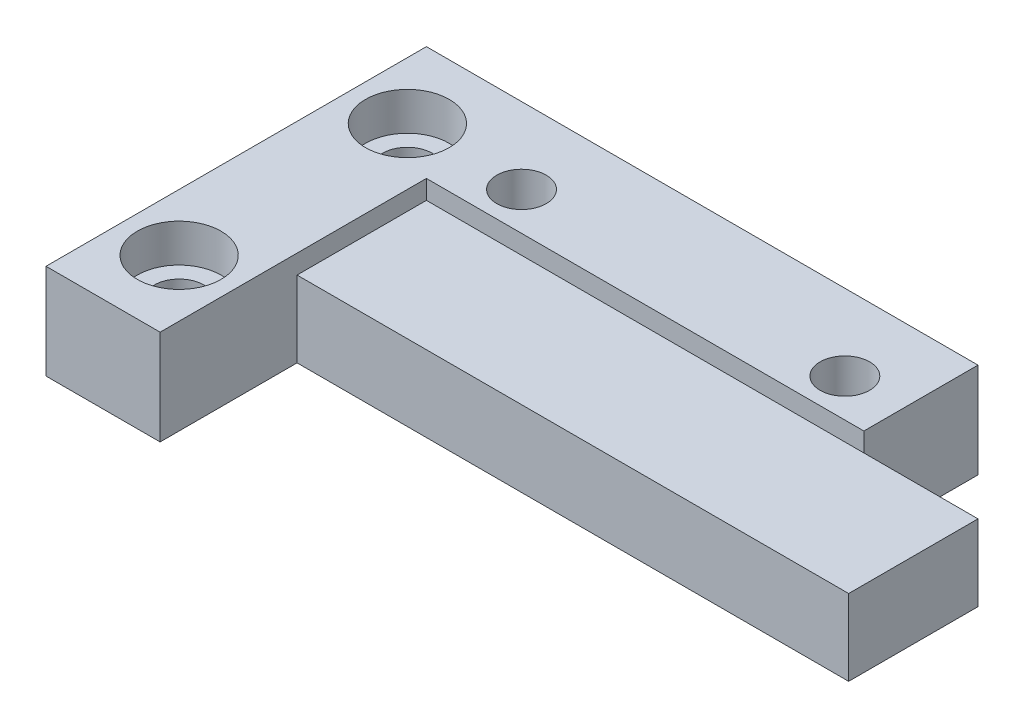
from build123d import *

# Parameters (mm, degrees)
SKETCH_1_W           = 35
SKETCH_1_H           = 20
EXTRUDE_1_DEPTH      = 5
SKETCH_2_W           = 29
SKETCH_2_H           = 14
CUT_EXTRUDE_2_DEPTH  = 1
SKETCH_3_W           = 29
SKETCH_3_H           = 7.2
CUT_EXTRUDE_4_DEPTH  = 41.620192023
SKETCH_4_W           = 6
SKETCH_4_H           = 6
CUT_EXTRUDE_5_DEPTH  = 41.620192023
SKETCH_5_R           = 1.3
CUT_EXTRUDE_6_DEPTH  = 41.620192023
CUT_EXTRUDE_START    = 5
CUT_EXTRUDE_8_DEPTH  = 2.3
SKETCH_6_R           = 2.2
CUT_EXTRUDE_10_DEPTH = 2
SKETCH_8_W           = 36.682005336
SKETCH_8_H           = 21.284799138
CUT_EXTRUDE_11_DEPTH = 5


with BuildPart() as part:
    # 草圖1 → 填料-伸長1 (new body)
    with BuildSketch(Plane(origin=(0, 0, 0), x_dir=(1, 0, 0), z_dir=(0, 1, 0))):
        with Locations((17.5, 10)):
            Rectangle(SKETCH_1_W, SKETCH_1_H)
    extrude_1 = extrude(amount=EXTRUDE_1_DEPTH)

    # 草圖2 → 除料-伸長2 (cut)
    with BuildSketch(Plane(origin=(0, 0, 0), x_dir=(1, 0, 0), z_dir=(0, 1, 0))):
        with Locations((20.5, 7)):
            Rectangle(SKETCH_2_W, SKETCH_2_H)
    cut_extrude_2 = extrude(amount=CUT_EXTRUDE_2_DEPTH, mode=Mode.SUBTRACT)

    # 草圖3 → 除料-伸長4 (cut, through all)
    with BuildSketch(Plane(origin=(0, 0, 0), x_dir=(1, 0, 0), z_dir=(0, 1, 0))):
        with Locations((20.5, 3.6)):
            Rectangle(SKETCH_3_W, SKETCH_3_H)
    cut_extrude_4 = extrude(amount=CUT_EXTRUDE_4_DEPTH, mode=Mode.SUBTRACT)

    # 草圖4 → 除料-伸長5 (cut, through all)
    with BuildSketch(Plane(origin=(0, 0, 0), x_dir=(1, 0, 0), z_dir=(0, 1, 0))):
        with Locations((32, 17)):
            Rectangle(SKETCH_4_W, SKETCH_4_H)
    cut_extrude_5 = extrude(amount=CUT_EXTRUDE_5_DEPTH, mode=Mode.SUBTRACT)

    # 草圖5 → 除料-伸長6 (cut, through all)
    with BuildSketch(Plane(origin=(0, 0, 0), x_dir=(1, 0, 0), z_dir=(0, 1, 0))):
        with Locations(Location((3, 16, 0), (0, 0, 270))):
            Circle(SKETCH_5_R)
        with Locations(Location((3, 4, 0), (0, 0, 270))):
            Circle(SKETCH_5_R)
        with Locations(Location((9, 16, 0), (0, 0, 270))):
            Circle(SKETCH_5_R)
        with Locations(Location((26, 16, 0), (0, 0, 270))):
            Circle(SKETCH_5_R)
    cut_extrude_6 = extrude(amount=CUT_EXTRUDE_6_DEPTH, mode=Mode.SUBTRACT)

    # 草圖7 → 除料-伸長8 (cut)
    with BuildSketch(Plane(origin=(0, 0, 0), x_dir=(1, 0, 0), z_dir=(0, 1, 0)).offset(CUT_EXTRUDE_START)):
        Polygon((26, 18.4), (23.921539031, 17.2), (23.921539031, 14.8), (26, 13.6), (28.078460969, 14.8), (28.078460969, 17.2), align=None)
        Polygon((9, 18.4), (6.921539031, 17.2), (6.921539031, 14.8), (9, 13.6), (11.078460969, 14.8), (11.078460969, 17.2), align=None)
    cut_extrude_8 = extrude(amount=-CUT_EXTRUDE_8_DEPTH, mode=Mode.SUBTRACT)

    # 草圖6 → 除料-伸長10 (cut)
    with BuildSketch(Plane(origin=(0, 0, 0), x_dir=(1, 0, 0), z_dir=(0, 1, 0))):
        with Locations(Location((3, 16, 0), (0, 0, 90))):
            Circle(SKETCH_6_R)
        with Locations(Location((3, 4, 0), (0, 0, 90))):
            Circle(SKETCH_6_R)
    cut_extrude_10 = extrude(amount=CUT_EXTRUDE_10_DEPTH, mode=Mode.SUBTRACT)

    # 鏡射4: 填料-伸長1, 除料-伸長2, 除料-伸長4, 除料-伸長5, 除料-伸長6, 除料-伸長8, 除料-伸長10 across plane
    add(extrude_1.mirror(Plane(origin=(0, 5, 0), x_dir=(0, 0, 1), z_dir=(0, -1, 0))))
    add(cut_extrude_2.mirror(Plane(origin=(0, 5, 0), x_dir=(0, 0, 1), z_dir=(0, -1, 0))), mode=Mode.SUBTRACT)
    add(cut_extrude_4.mirror(Plane(origin=(0, 5, 0), x_dir=(0, 0, 1), z_dir=(0, -1, 0))), mode=Mode.SUBTRACT)
    add(cut_extrude_5.mirror(Plane(origin=(0, 5, 0), x_dir=(0, 0, 1), z_dir=(0, -1, 0))), mode=Mode.SUBTRACT)
    add(cut_extrude_6.mirror(Plane(origin=(0, 5, 0), x_dir=(0, 0, 1), z_dir=(0, -1, 0))), mode=Mode.SUBTRACT)
    add(cut_extrude_8.mirror(Plane(origin=(0, 5, 0), x_dir=(0, 0, 1), z_dir=(0, -1, 0))), mode=Mode.SUBTRACT)
    add(cut_extrude_10.mirror(Plane(origin=(0, 5, 0), x_dir=(0, 0, 1), z_dir=(0, -1, 0))), mode=Mode.SUBTRACT)

    # 草圖8 → 除料-伸長11 (cut)
    with BuildSketch(Plane(origin=(0, 0, 0), x_dir=(1, 0, 0), z_dir=(0, 1, 0))):
        with Locations((18.341002668, 10.642399569)):
            Rectangle(SKETCH_8_W, SKETCH_8_H)
    extrude(amount=CUT_EXTRUDE_11_DEPTH, mode=Mode.SUBTRACT)


solid = part.part
